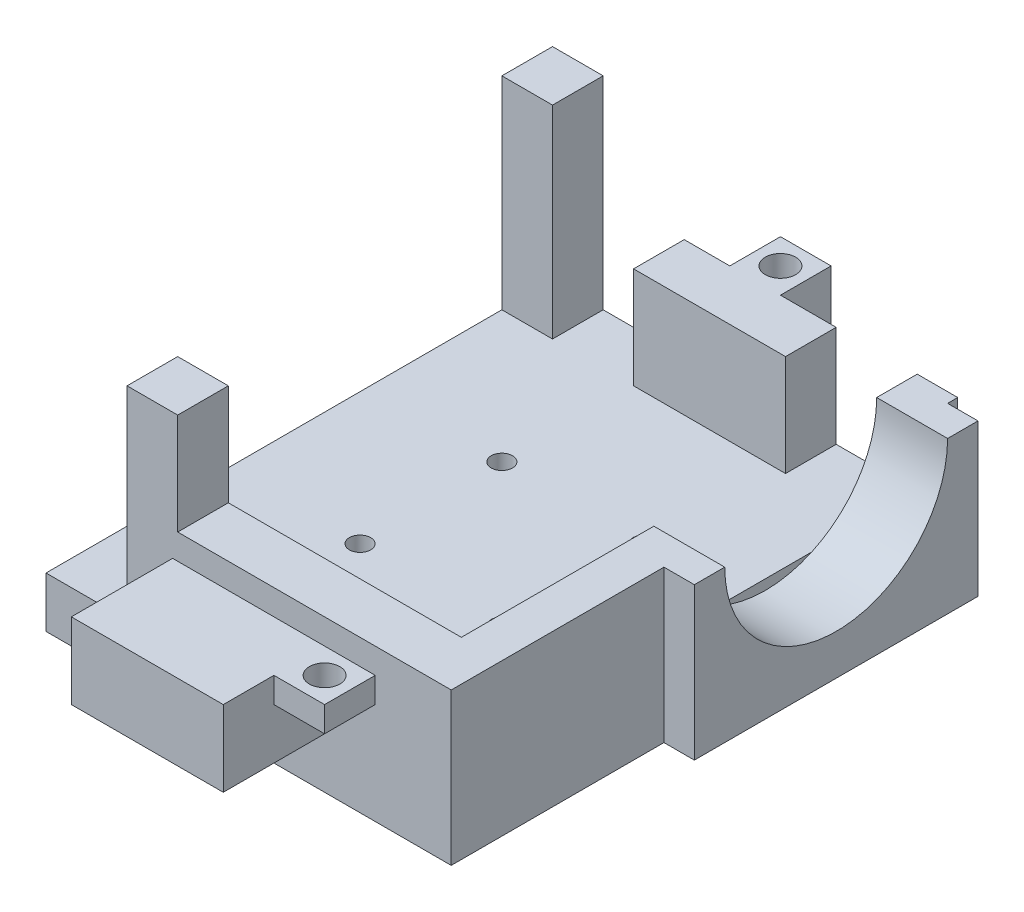
from build123d import *

# Parameters (mm, degrees)
SKETCH1_W            = 40
SKETCH1_H            = 50
BOSS_EXTRUDE1_DEPTH  = 5
SKETCH4_W            = 5
SKETCH4_H            = 5
BOSS_EXTRUDE4_DEPTH  = 20
SKETCH4_4_W          = 15
SKETCH4_4_H          = 5
BOSS_EXTRUDE5_DEPTH  = 10
CUT_EXTRUDE2_DEPTH   = 4
BOSS_EXTRUDE7_START  = 3
BOSS_EXTRUDE7_DEPTH  = 3
SKETCH11_W           = 5
SKETCH11_H           = 5
BOSS_EXTRUDE8_DEPTH  = 5
SKETCH12_R           = 1.5
CUT_EXTRUDE6_DEPTH   = 5
SKETCH15_W           = 5
SKETCH15_H           = 2.5
BOSS_EXTRUDE11_DEPTH = 5
BOSS_EXTRUDE12_DEPTH = 10
SKETCH16_R           = 1.5
CUT_EXTRUDE8_DEPTH   = 2.5
SKETCH18_R           = 1.05
CUT_EXTRUDE9_DEPTH   = 5


with BuildPart() as part:
    # Sketch1 → Boss-Extrude1 (new body)
    with BuildSketch(Plane(origin=(0, 0, 0), x_dir=(1, 0, 0), z_dir=(0, 1, 0))):
        Rectangle(SKETCH1_W, SKETCH1_H)
    extrude(amount=BOSS_EXTRUDE1_DEPTH)

    # Sketch4 → Boss-Extrude4 (add)
    with BuildSketch(Plane(origin=(0, 5, 0), x_dir=(1, 0, 0), z_dir=(0, 1, 0))):
        with Locations((-9.5, -22.5)):
            Rectangle(SKETCH4_W, SKETCH4_H)
        with Locations((-17.5, 22.5)):
            Rectangle(SKETCH4_W, SKETCH4_H)
    extrude(amount=BOSS_EXTRUDE4_DEPTH)

    # Sketch4<4> → Boss-Extrude5 (add)
    with BuildSketch(Plane(origin=(0, 5, 0), x_dir=(1, 0, 0), z_dir=(0, 1, 0))):
        Polygon((20, -25), (20, 25), (16, 25), (16, -20), (-7, -20), (-7, -25), align=None)
        with Locations((0.5, 22.5)):
            Rectangle(SKETCH4_4_W, SKETCH4_4_H)
    extrude(amount=BOSS_EXTRUDE5_DEPTH)

    # Sketch7 → Cut-Extrude2 (cut)
    with BuildSketch(Plane(origin=(20, 0, 0), x_dir=(0, 0, -1), z_dir=(1, 0, 0))):
        with BuildLine():
            Line((-1, 15), (21, 15))
            ThreePointArc((21, 15), (10, 4), (-1, 15))
        make_face()
    extrude(amount=-CUT_EXTRUDE2_DEPTH, mode=Mode.SUBTRACT)

    # Sketch8 → Boss-Extrude7 (add)
    with BuildSketch(Plane(origin=(20, 0, 0), x_dir=(0, 0, -1), z_dir=(1, 0, 0)).offset(BOSS_EXTRUDE7_START)):
        with BuildLine():
            Line((-1, 15), (-4, 15))
            Line((-4, 15), (-4, 0))
            Line((-4, 0), (24, 0))
            Line((24, 0), (24, 15))
            Line((24, 15), (21, 15))
            ThreePointArc((21, 15), (10, 4), (-1, 15))
        make_face()
    extrude(amount=-BOSS_EXTRUDE7_DEPTH)

    # Sketch11 → Boss-Extrude8 (add)
    with BuildSketch(Plane(origin=(0, 0, -25), x_dir=(-1, 0, 0), z_dir=(0, 0, -1))):
        with Locations((0, 12.5)):
            Rectangle(SKETCH11_W, SKETCH11_H)
    extrude(amount=BOSS_EXTRUDE8_DEPTH)

    # Sketch12 → Cut-Extrude6 (cut)
    with BuildSketch(Plane.XZ.offset(-10)):
        with Locations((0, -27.5)):
            Circle(SKETCH12_R)
    extrude(amount=-CUT_EXTRUDE6_DEPTH, mode=Mode.SUBTRACT)

    # Sketch15 → Boss-Extrude11 (add)
    with BuildSketch(Plane.XY.offset(25)):
        with Locations((10, 11.25)):
            Rectangle(SKETCH15_W, SKETCH15_H)
    extrude(amount=BOSS_EXTRUDE11_DEPTH)

    # Sketch15<3> → Boss-Extrude12 (add)
    with BuildSketch(Plane.XY.offset(25)):
        Polygon((7.5, 10), (7.5, 12.5), (-7.5, 12.5), (-7.5, 5), (7.5, 5), align=None)
    extrude(amount=BOSS_EXTRUDE12_DEPTH)

    # Sketch16 → Cut-Extrude8 (cut)
    with BuildSketch(Plane.XZ.offset(-10)):
        with Locations((10, 27.5)):
            Circle(SKETCH16_R)
    extrude(amount=-CUT_EXTRUDE8_DEPTH, mode=Mode.SUBTRACT)

    # Sketch18 → Cut-Extrude9 (cut)
    with BuildSketch(Plane.XZ):
        with Locations((-7, 7)):
            Circle(SKETCH18_R)
        with Locations((7, 7)):
            Circle(SKETCH18_R)
        with Locations((7, -7)):
            Circle(SKETCH18_R)
        with Locations((-7, -7)):
            Circle(SKETCH18_R)
    extrude(amount=-CUT_EXTRUDE9_DEPTH, mode=Mode.SUBTRACT)


solid = part.part
